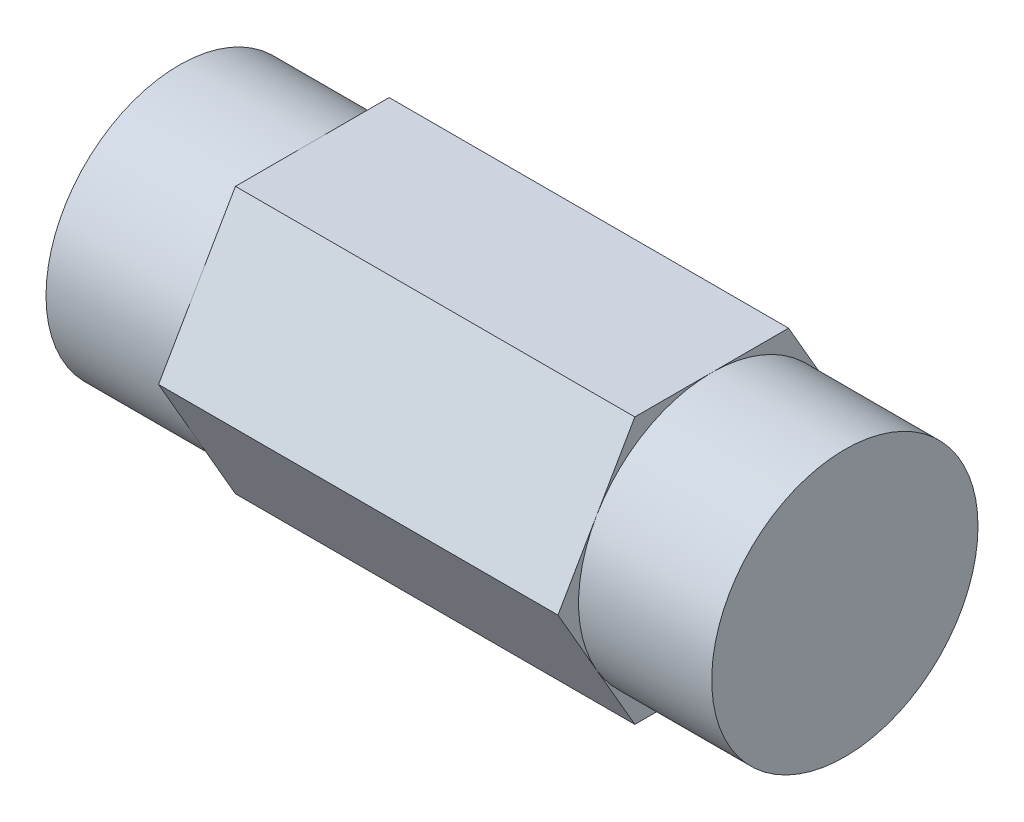
from build123d import *

# Parameters (mm, degrees)
BOSS_EXTRUDE1_DEPTH = 19.05
SKETCH2_R           = 6.35
BOSS_EXTRUDE2_DEPTH = 6.35
BOSS_EXTRUDE3_START = 6.35
SKETCH3_R           = 6.35
BOSS_EXTRUDE3_DEPTH = 6.35


with BuildPart() as part:
    # Sketch1 → Boss-Extrude1 (new body)
    with BuildSketch(Plane(origin=(0, 0, 0), x_dir=(0, 0, -1), z_dir=(1, 0, 0))):
        Polygon((-3.666174209, -6.35), (3.666174209, -6.35), (7.332348419, 0), (3.666174209, 6.35), (-3.666174209, 6.35), (-7.332348419, 0), align=None)
    extrude(amount=BOSS_EXTRUDE1_DEPTH)

    # Sketch2 → Boss-Extrude2 (add)
    with BuildSketch(Plane(origin=(19.05, 0, 0), x_dir=(0, 0, -1), z_dir=(1, 0, 0))):
        with Locations(Location((0, 0, 0), (0, 0, 150))):
            Circle(SKETCH2_R)
    extrude(amount=BOSS_EXTRUDE2_DEPTH)

    # Sketch3 → Boss-Extrude3 (add)
    with BuildSketch(Plane.ZY.offset(BOSS_EXTRUDE3_START)):
        with Locations(Location((0, 0, 0), (0, 0, 30))):
            Circle(SKETCH3_R)
    extrude(amount=-BOSS_EXTRUDE3_DEPTH)


solid = part.part
